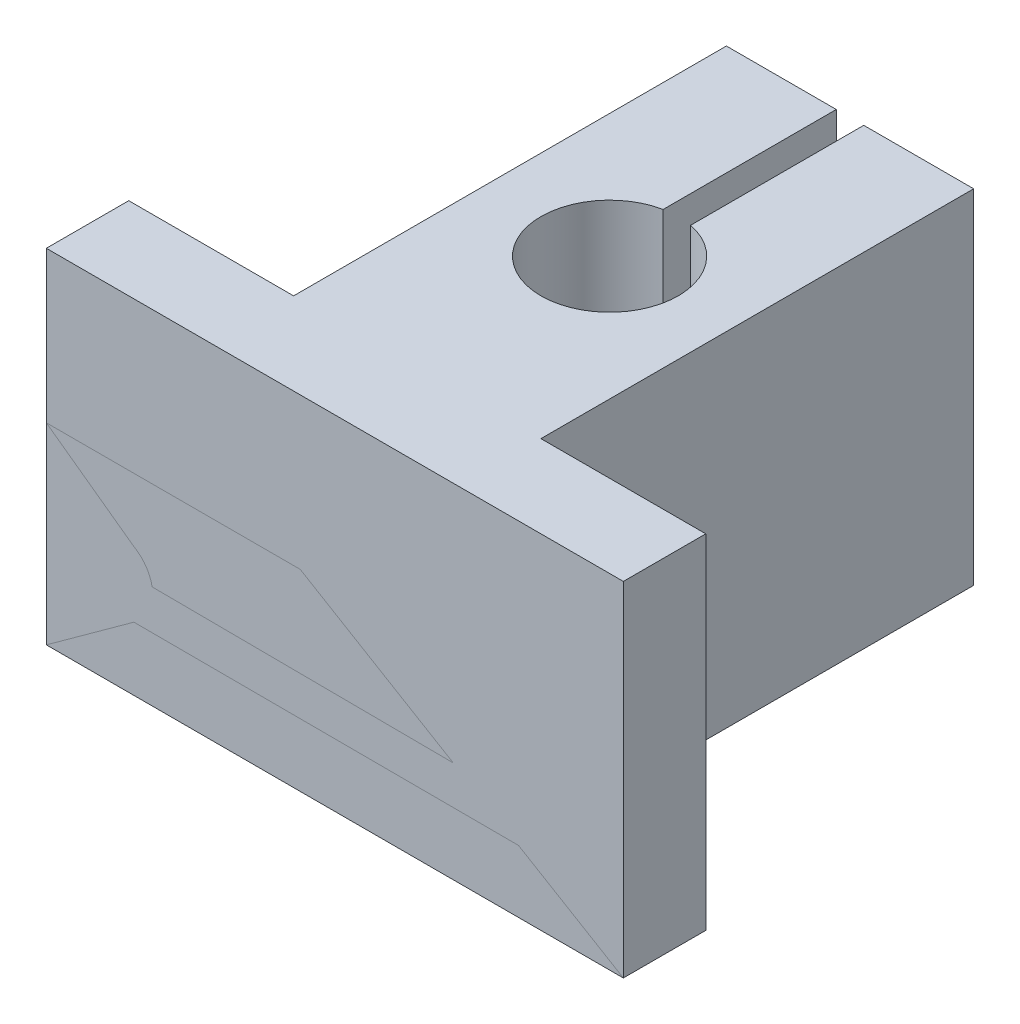
from build123d import *

# Parameters (mm, degrees)
EXTRUDE_2_DEPTH     = 25
EXTRUDE_6_DEPTH     = 14
SKETCH_5_R          = 2.75
CUT_EXTRUDE_1_DEPTH = 46.367940222
SKETCH_6_R          = 2
CUT_EXTRUDE_2_DEPTH = 51.17220346


with BuildPart() as part:
    # Эскиз2 → Бобышка-Вытянуть2 (new body)
    with BuildSketch(Plane(origin=(0, 0, 0), x_dir=(1, 0, 0), z_dir=(0, 1, 0))):
        with BuildLine():
            Line((-21, 0), (-9, 0))
            Line((-9, 0), (-9, 31.5))
            Line((-9, 31.5), (-1, 31.5))
            Line((-1, 31.5), (-1, 18.898979486))
            ThreePointArc((-1, 18.898979486), (0, 9), (1, 18.898979486))
            Line((1, 18.898979486), (1, 31.5))
            Line((1, 31.5), (9, 31.5))
            Line((9, 31.5), (9, 0))
            Line((9, 0), (21, 0))
            Line((21, 0), (21, -6))
            Line((21, -6), (-21, -6))
            Line((-21, -6), (-21, 0))
        make_face()
    extrude(amount=EXTRUDE_2_DEPTH)


with BuildPart() as body_2:
    # Эскиз2<2> → Бобышка-Вытянуть6 (new body)
    with BuildSketch(Plane(origin=(0, 0, 0), x_dir=(1, 0, 0), z_dir=(0, 1, 0))):
        with BuildLine():
            Line((-21, 0), (-9, 0))
            Line((-9, 0), (-9, 31.5))
            Line((-9, 31.5), (-1, 31.5))
            Line((-1, 31.5), (-1, 18.898979486))
            ThreePointArc((-1, 18.898979486), (0, 9), (1, 18.898979486))
            Line((1, 18.898979486), (1, 31.5))
            Line((1, 31.5), (9, 31.5))
            Line((9, 31.5), (9, 0))
            Line((9, 0), (21, 0))
            Line((21, 0), (21, -6))
            Line((21, -6), (-21, -6))
            Line((-21, -6), (-21, 0))
        make_face()
    extrude(amount=EXTRUDE_6_DEPTH)

    # Эскиз5 → Вырез-Вытянуть1 (cut, through all)
    with BuildSketch(Plane(origin=(0, 0, 0), x_dir=(-1, 0, 0), z_dir=(0, 0, -1))):
        with Locations((-16, 7)):
            Circle(SKETCH_5_R)
        with Locations((16, 7)):
            Circle(SKETCH_5_R)
    extrude(amount=-CUT_EXTRUDE_1_DEPTH, mode=Mode.SUBTRACT)

    # Эскиз6 → Вырез-Вытянуть2 (cut, through all)
    with BuildSketch(Plane.ZY.offset(9)):
        with Locations((-26.5, 7)):
            Circle(SKETCH_6_R)
    extrude(amount=-CUT_EXTRUDE_2_DEPTH, mode=Mode.SUBTRACT)


solid = Compound([part.part, body_2.part])
